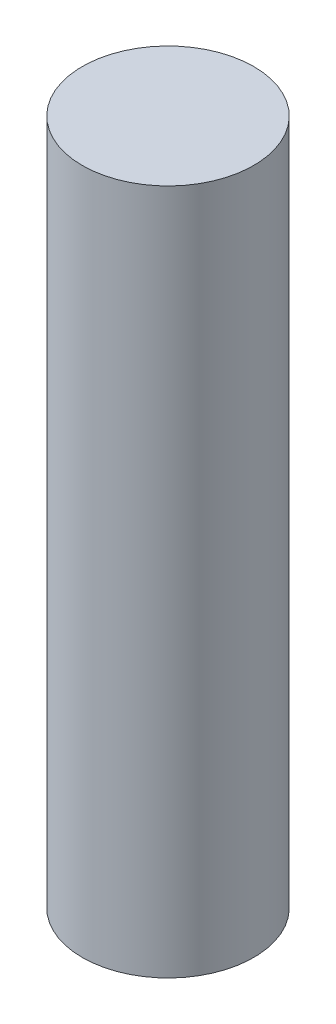
from build123d import *

# Parameters (mm, degrees)
SKETCH1_R           = 10
BOSS_EXTRUDE1_DEPTH = 80


with BuildPart() as part:
    # Sketch1 → Boss-Extrude1 (new body)
    with BuildSketch(Plane(origin=(0, 0, 0), x_dir=(1, 0, 0), z_dir=(0, 1, 0))):
        with Locations(Location((0, 0, 0), (0, 0, 270))):
            Circle(SKETCH1_R)
    extrude(amount=BOSS_EXTRUDE1_DEPTH)


solid = part.part
